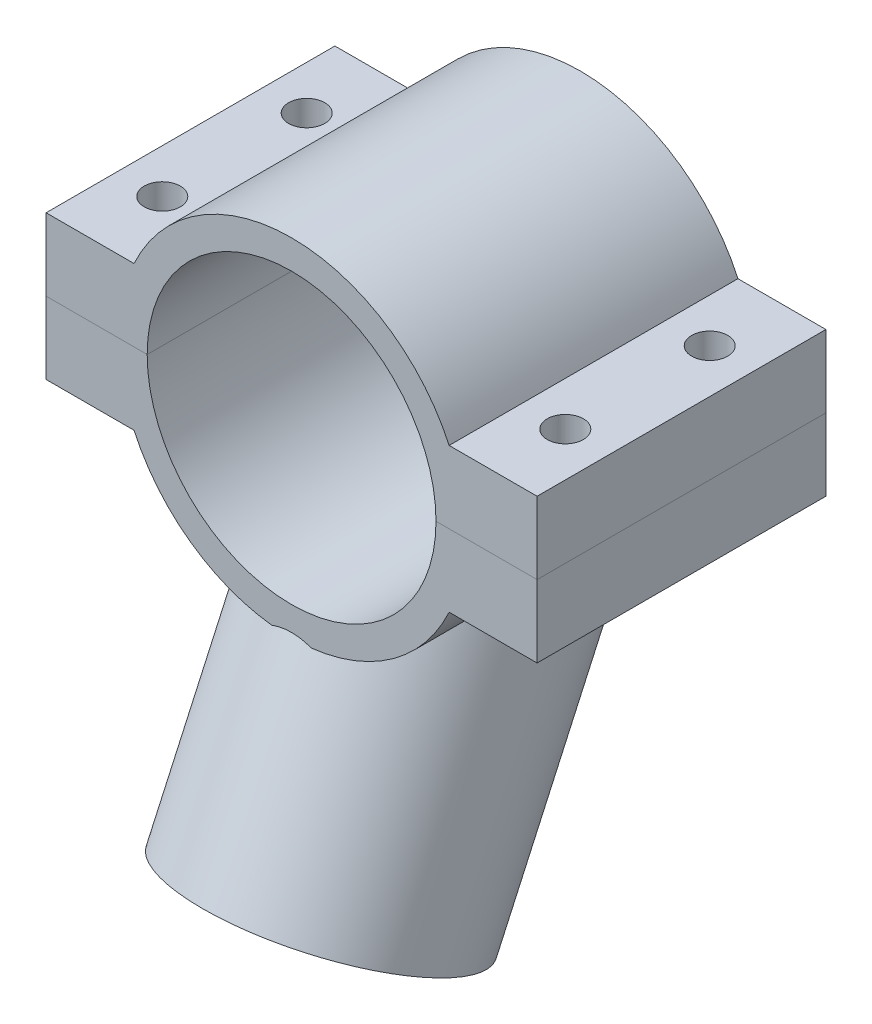
from build123d import *

# Parameters (mm, degrees)
SKETCH1_R                       = 24
SKETCH1_R_2                     = 20
BOSS_EXTRUDE1_DEPTH             = 40
BOSS_EXTRUDE2_DEPTH             = 10
BOSS_EXTRUDE2_DEPTH_BACK        = 10
SKETCH2_W                       = 14
SKETCH2_H                       = 40
CUT_EXTRUDE1_REACH              = 64.546
SKETCH5_R                       = 2.5
SKETCH6_R                       = 18
BOSS_EXTRUDE4_DEPTH             = 30
BOSS_EXTRUDE4_DIRECTION_2_REACH = 73.632


with BuildPart() as part:
    # Sketch1 → Boss-Extrude1 (new body)
    with BuildSketch(Plane.XY):
        Circle(SKETCH1_R)
        Circle(SKETCH1_R_2, mode=Mode.SUBTRACT)
    extrude(amount=BOSS_EXTRUDE1_DEPTH)

    # Sketch2 → Boss-Extrude2 (add, two sides: drawn at the far end of the back side and taken through both)
    with BuildSketch(Plane(origin=(0, 0, 0), x_dir=(1, 0, 0), z_dir=(0, 1, 0)).offset(-BOSS_EXTRUDE2_DEPTH_BACK)):
        with Locations((-27, -20)):
            Rectangle(SKETCH2_W, SKETCH2_H)
        with Locations((27, -20)):
            Rectangle(SKETCH2_W, SKETCH2_H)
    extrude(amount=BOSS_EXTRUDE2_DEPTH + BOSS_EXTRUDE2_DEPTH_BACK)

    # Sketch5 → Cut-Extrude1 (cut, up to next)
    with BuildSketch(Plane(origin=(0, 10, 0), x_dir=(1, 0, 0), z_dir=(0, 1, 0)), mode=Mode.PRIVATE) as cut_extrude1_sk1:
        with Locations((-27.908712115, -10)):
            Circle(SKETCH5_R)
    cut_extrude1_tool1 = extrude(cut_extrude1_sk1.sketch, amount=-CUT_EXTRUDE1_REACH, mode=Mode.PRIVATE) & part.part
    # Sketch5 → Cut-Extrude1 (cut, up to next)
    with BuildSketch(Plane(origin=(0, 10, 0), x_dir=(1, 0, 0), z_dir=(0, 1, 0)), mode=Mode.PRIVATE) as cut_extrude1_sk2:
        with Locations((-27.908712115, -30)):
            Circle(SKETCH5_R)
    cut_extrude1_tool2 = extrude(cut_extrude1_sk2.sketch, amount=-CUT_EXTRUDE1_REACH, mode=Mode.PRIVATE) & part.part
    cut_extrude1_1 = cut_extrude1_tool1.solids().sort_by_distance((-27.908712, 10, 10))[0]
    add(cut_extrude1_1, mode=Mode.SUBTRACT)
    cut_extrude1_2 = cut_extrude1_tool2.solids().sort_by_distance((-27.908712, 10, 30))[0]
    add(cut_extrude1_2, mode=Mode.SUBTRACT)
    cut_extrude1 = cut_extrude1_1 + cut_extrude1_2  # Cut-Extrude1 as one shape, for the pattern or mirror that repeats it

    # Mirror1: Cut-Extrude1 across plane
    add(cut_extrude1.mirror(Plane(origin=(0, 0, 0), x_dir=(0, 0, 1), z_dir=(1, 0, 0))), mode=Mode.SUBTRACT)


with BuildPart() as body_2:
    # Split1: the piece on the far side of the plane
    add(part.part)
    split(bisect_by=Plane.ZX, keep=Keep.BOTTOM)

    # Sketch6 → Boss-Extrude4 (add)
    with BuildSketch(Plane(origin=(0, -34.112734586, 15.546068799), x_dir=(1, 0, 0), z_dir=(0, -0.9099612708765458, 0.41469324265623353))):
        with Locations((0, 8.720962066)):
            Circle(SKETCH6_R)
    extrude(amount=BOSS_EXTRUDE4_DEPTH)

    # Sketch6 → Boss-Extrude4 direction 2 (add, up to next)
    with BuildSketch(Plane(origin=(0, -34.112734586, 15.546068799), x_dir=(1, 0, 0), z_dir=(0, -0.9099612708765458, 0.41469324265623353)), mode=Mode.PRIVATE) as boss_extrude4_direction_2_sk1:
        with Locations((0, 8.720962066)):
            Circle(SKETCH6_R)
    boss_extrude4_direction_2_tool1 = extrude(boss_extrude4_direction_2_sk1.sketch, amount=-BOSS_EXTRUDE4_DIRECTION_2_REACH, mode=Mode.PRIVATE) - body_2.part
    add(boss_extrude4_direction_2_tool1.solids().sort_by_distance((0, -30.496211, 23.481807))[0])


with BuildPart() as part_1:
    add(part.part)

    # Split1
    split(bisect_by=Plane.ZX, keep=Keep.TOP)


solid = Compound([body_2.part, part_1.part])
